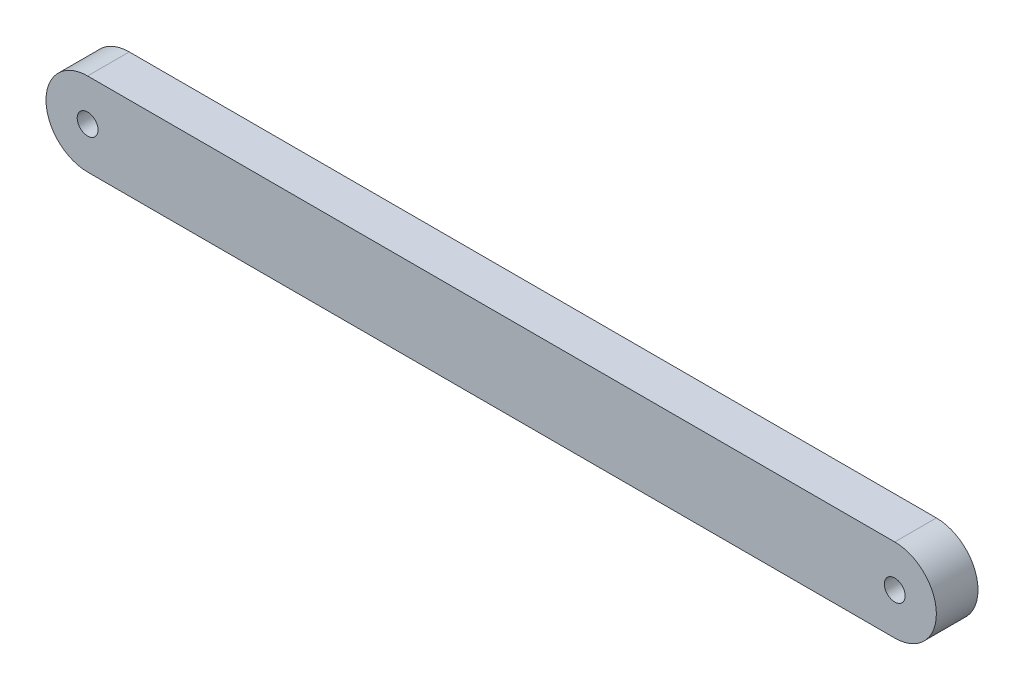
from build123d import *

# Parameters (mm, degrees)
SKETCH1_W                 = 106.9335
SKETCH1_H                 = 10
BOSS_EXTRUDE1_DEPTH       = 5
FILLET1_RADIUS            = 5
FILLET1_LENGTH            = 5
FILLET2_RADIUS            = 5
FILLET2_LENGTH            = 5
M3X0_5_TAPPED_HOLE1_D     = 2.5
M3X0_5_TAPPED_HOLE1_DEPTH = 29.81
M3X0_5_TAPPED_HOLE1_TIP   = 0.751075774


with BuildPart() as part:
    # Sketch1 → Boss-Extrude1 (new body)
    with BuildSketch(Plane.XY):
        Rectangle(SKETCH1_W, SKETCH1_H)
    extrude(amount=BOSS_EXTRUDE1_DEPTH)

    # Fillet1: full round fillet: the end face becomes a half cylinder, R = half its width
    fillet1_face = Plane((-53.46675, 0, 2.5), x_dir=(0, 0, 1), z_dir=(-1, 0, 0))  # on the end face: x along it, z out of the body
    fillet1_slab = fillet1_face.offset(-FILLET1_RADIUS / 2) * Box(FILLET1_LENGTH, 2 * FILLET1_RADIUS, FILLET1_RADIUS, mode=Mode.PRIVATE)  # the body's end, R deep
    fillet1_round = Plane((-48.46675, 0, 2.5), x_dir=(-1, 0, 0), z_dir=(0, 0, 1)) * Cylinder(FILLET1_RADIUS, FILLET1_LENGTH, mode=Mode.PRIVATE)  # its axis R under the face
    add(fillet1_slab - fillet1_round, mode=Mode.SUBTRACT)

    # Fillet2: full round fillet: the end face becomes a half cylinder, R = half its width
    fillet2_face = Plane((53.46675, 0, 2.5), x_dir=(0, 0, -1), z_dir=(1, 0, 0))  # on the end face: x along it, z out of the body
    fillet2_slab = fillet2_face.offset(-FILLET2_RADIUS / 2) * Box(FILLET2_LENGTH, 2 * FILLET2_RADIUS, FILLET2_RADIUS, mode=Mode.PRIVATE)  # the body's end, R deep
    fillet2_round = Plane((48.46675, 0, 2.5), x_dir=(1, 0, 0), z_dir=(0, 0, -1)) * Cylinder(FILLET2_RADIUS, FILLET2_LENGTH, mode=Mode.PRIVATE)  # its axis R under the face
    add(fillet2_slab - fillet2_round, mode=Mode.SUBTRACT)

    # M3x0.5 Tapped Hole1
    with Locations(Plane.XY.offset(5)):
        with Locations((-48.46675, 0), (48.46675, 0)):
            Hole(M3X0_5_TAPPED_HOLE1_D / 2, depth=M3X0_5_TAPPED_HOLE1_DEPTH)
            with Locations((0, 0, -(M3X0_5_TAPPED_HOLE1_DEPTH + M3X0_5_TAPPED_HOLE1_TIP / 2))):  # 118° drill point
                Cone(0, M3X0_5_TAPPED_HOLE1_D / 2, M3X0_5_TAPPED_HOLE1_TIP, mode=Mode.SUBTRACT)


solid = part.part
